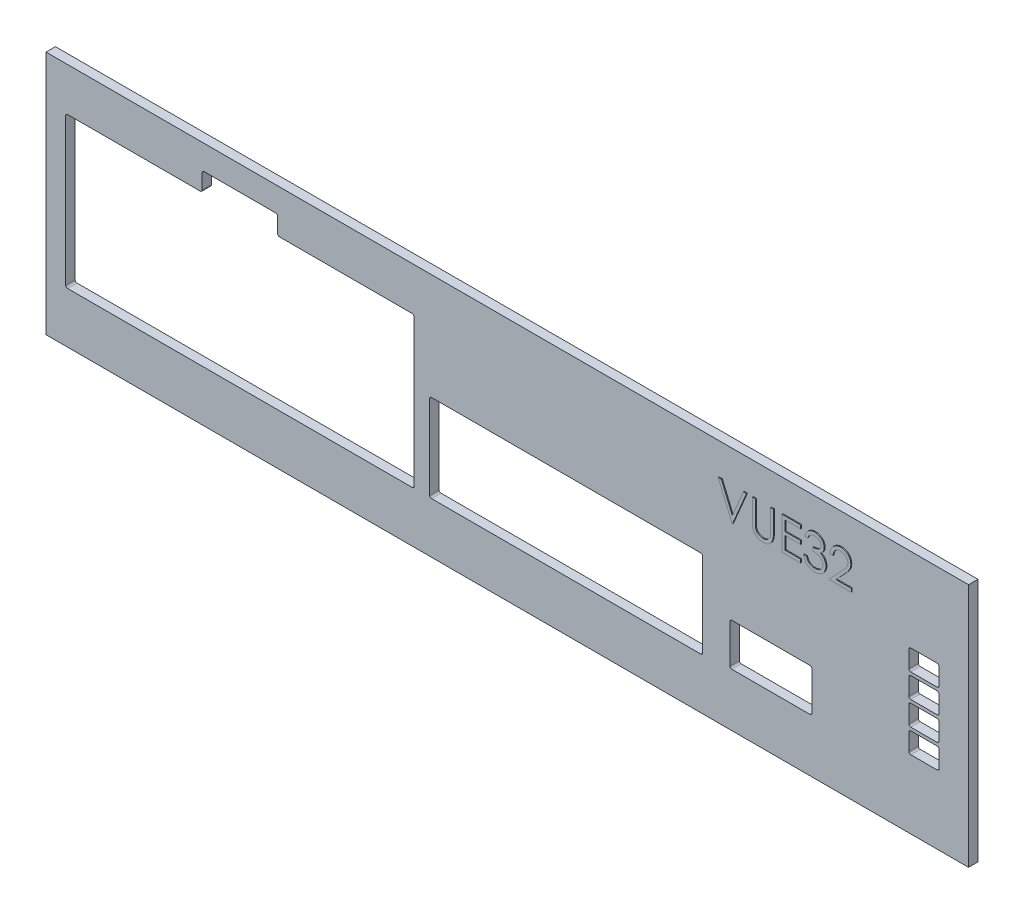
from build123d import *

# Parameters (mm, degrees)
ESQUISSE1_W             = 98
ESQUISSE1_H             = 26
BOSS_EXTRU_1_DEPTH      = 1
ESQUISSE2_W             = 29
ESQUISSE2_H             = 9.3
ESQUISSE2_W_2           = 8.7
ESQUISSE2_H_2           = 4.5
ESQUISSE2_W_3           = 3.2
ESQUISSE2_H_3           = 2.2
ENL_V_MAT_EXTRU_1_DEPTH = 51.705029336
CONG_1_R                = 0.2
BOSS_EXTRU_2_DEPTH      = 0.1


with BuildPart() as part:
    # Esquisse1 → Boss.-Extru.1 (new body)
    with BuildSketch(Plane.XY):
        Rectangle(ESQUISSE1_W, ESQUISSE1_H)
    extrude(amount=BOSS_EXTRU_1_DEPTH)

    # Esquisse2 → Enlèv. mat.-Extru.1 (cut, through all)
    with BuildSketch(Plane.XY.offset(1)):
        Polygon((-46.9074, 8.4), (-32.4074, 8.4), (-32.4074, 10.4), (-24.4074, 10.4), (-24.4074, 8.4), (-9.9074, 8.4), (-9.9074, -7.6), (-46.9074, -7.6), align=None)
        with Locations((6.25, -2.95)):
            Rectangle(ESQUISSE2_W, ESQUISSE2_H)
        with Locations((28, -5.1)):
            Rectangle(ESQUISSE2_W_2, ESQUISSE2_H_2)
        with Locations((44.255985376, 3.01)):
            Rectangle(ESQUISSE2_W_3, ESQUISSE2_H_3)
        with Locations((44.255985376, 0.47)):
            Rectangle(ESQUISSE2_W_3, ESQUISSE2_H_3)
        with Locations((44.255985376, -2.07)):
            Rectangle(ESQUISSE2_W_3, ESQUISSE2_H_3)
        with Locations((44.255985376, -4.61)):
            Rectangle(ESQUISSE2_W_3, ESQUISSE2_H_3)
    extrude(amount=-ENL_V_MAT_EXTRU_1_DEPTH, mode=Mode.SUBTRACT)

    # Congé1
    cong_1_edges = [part.edges().sort_by_distance(p)[0] for p in [
        (45.855985376, -3.51, 0.5),
        (45.855985376, -5.71, 0.5),
        (42.655985376, -5.71, 0.5),
        (42.655985376, -3.51, 0.5),
        (-46.9074, -7.6, 0.5),
        (-46.9074, 8.4, 0.5),
        (-32.4074, 8.4, 0.5),
        (-32.4074, 10.4, 0.5),
        (-24.4074, 10.4, 0.5),
        (-24.4074, 8.4, 0.5),
        (-9.9074, 8.4, 0.5),
        (-9.9074, -7.6, 0.5),
        (-8.25, -7.6, 0.5),
        (-8.25, 1.7, 0.5),
        (20.75, 1.7, 0.5),
        (20.75, -7.6, 0.5),
        (23.65, -7.35, 0.5),
        (23.65, -2.85, 0.5),
        (32.35, -2.85, 0.5),
        (32.35, -7.35, 0.5),
        (45.855985376, 4.11, 0.5),
        (45.855985376, 1.91, 0.5),
        (42.655985376, 1.91, 0.5),
        (42.655985376, 4.11, 0.5),
        (45.855985376, 1.57, 0.5),
        (45.855985376, -0.63, 0.5),
        (42.655985376, -0.63, 0.5),
        (42.655985376, 1.57, 0.5),
        (45.855985376, -0.97, 0.5),
        (45.855985376, -3.17, 0.5),
        (42.655985376, -3.17, 0.5),
        (42.655985376, -0.97, 0.5),
    ]]
    fillet(cong_1_edges, radius=CONG_1_R)

    # Esquisse3 → Boss.-Extru.2 (add)
    with BuildSketch(Plane.XY.offset(1)):
        Polygon((22.502465032, 9.673866066), (22.839003494, 9.673866066), (24.00567016, 6.915652925), (25.172336827, 9.673866066), (25.508875288, 9.673866066), (24.028106058, 6.173866066), (23.983234263, 6.173866066), align=None)
        with BuildLine():
            Line((26.137080417, 9.673866066), (26.451182981, 9.673866066))
            Line((26.451182981, 9.673866066), (26.451182981, 7.576810777))
            add(Edge.make_bspline(
                [(26.451182981, 7.576810777), (26.451136237, 7.547130042), (26.451047532, 7.490805731), (26.451640046, 7.41063743), (26.453299414, 7.339364971), (26.454345574, 7.276713624), (26.456672907, 7.222970876), (26.458570954, 7.177845566), (26.461011511, 7.141551363), (26.463944628, 7.120370437), (26.465205417, 7.111265906)],
                knots=[0, 0, 0, 0, 1.528628734, 2.90083645, 4.128790002, 5.200304208, 6.127813768, 6.898992206, 7.526736466, 8, 8, 8, 8], degree=3))
            add(Edge.make_bspline(
                [(26.465205417, 7.111265906), (26.470382875, 7.078419142), (26.480446062, 7.014576413), (26.506092439, 6.923668131), (26.54190994, 6.841736673), (26.584352983, 6.766225382), (26.640285595, 6.699236022), (26.70728913, 6.637524369), (26.788466898, 6.583552564), (26.878727504, 6.534201753), (26.976012742, 6.49453667), (27.075424008, 6.464543306), (27.175466987, 6.446264406), (27.242443152, 6.444147867), (27.275702211, 6.443096835)],
                knots=[0, 0, 0, 0, 1.035780045, 2.013197591, 2.933192213, 3.817615948, 4.702609284, 5.640816605, 6.646850145, 7.73207398, 8.84249596, 9.914020372, 10.964143139, 12, 12, 12, 12], degree=3))
            add(Edge.make_bspline(
                [(27.275702211, 6.443096835), (27.304255952, 6.444170685), (27.361198514, 6.446312184), (27.445804944, 6.459573615), (27.528205053, 6.48347418), (27.608805733, 6.514313939), (27.684356717, 6.55506153), (27.754900159, 6.602132369), (27.817864094, 6.657343245), (27.875322091, 6.71844359), (27.925357027, 6.78738339), (27.968728169, 6.862661528), (28.004254099, 6.945410875), (28.021797623, 7.003565297), (28.030810385, 7.033441386)],
                knots=[0, 0, 0, 0, 0.994687771, 1.983630487, 2.973142513, 3.978332533, 4.983357753, 5.956394766, 6.925816176, 7.893390482, 8.871859704, 9.88551698, 10.913711441, 12, 12, 12, 12], degree=3))
            add(Edge.make_bspline(
                [(28.030810385, 7.033441386), (28.03381051, 7.045789961), (28.040495998, 7.073307561), (28.046743043, 7.119828851), (28.053249568, 7.174718215), (28.057764138, 7.238370028), (28.062165359, 7.310571001), (28.064798432, 7.391697258), (28.066015465, 7.481454219), (28.066378145, 7.544091381), (28.066567596, 7.576810777)],
                knots=[0, 0, 0, 0, 0.558680831, 1.244966039, 2.062412453, 2.990489873, 4.051219941, 5.244515665, 6.560634259, 8, 8, 8, 8], degree=3))
            Line((28.066567596, 7.576810777), (28.066567596, 9.673866066))
            Line((28.066567596, 9.673866066), (28.38067016, 9.673866066))
            Line((28.38067016, 9.673866066), (28.38067016, 7.559983854))
            add(Edge.make_bspline(
                [(28.38067016, 7.559983854), (28.38041604, 7.521885475), (28.379920108, 7.447534173), (28.375619532, 7.338582814), (28.368762532, 7.235229832), (28.359074444, 7.137461336), (28.346237441, 7.045627176), (28.33196222, 6.958922408), (28.313782687, 6.877969416), (28.292549286, 6.802136998), (28.268275738, 6.729951485), (28.23683459, 6.66144287), (28.20141009, 6.59452847), (28.159395437, 6.530220361), (28.112184054, 6.468233808), (28.058732374, 6.408944733), (28.000808213, 6.351405687), (27.937448653, 6.297092621), (27.869698128, 6.247283944), (27.79775817, 6.203486173), (27.7221814, 6.166462555), (27.643164274, 6.135986631), (27.560673071, 6.113072032), (27.474705712, 6.095996876), (27.385066518, 6.086294578), (27.324101862, 6.084852648), (27.293230256, 6.084122476)],
                knots=[0, 0, 0, 0, 1.316592851, 2.569410997, 3.76748051, 4.895814652, 5.963796859, 6.97159953, 7.931736103, 8.829262218, 9.692595152, 10.560224239, 11.431080259, 12.30701507, 13.211635791, 14.121146779, 15.063487852, 16.031507147, 17.00238618, 17.966455255, 18.938106653, 19.907068911, 20.888905087, 21.893141452, 22.933117798, 24, 24, 24, 24], degree=3))
            add(Edge.make_bspline(
                [(27.293230256, 6.084122476), (27.259561154, 6.084907241), (27.193502495, 6.086446948), (27.096164428, 6.095269698), (27.002850231, 6.111888093), (26.912574354, 6.133048036), (26.826565857, 6.162231774), (26.743672413, 6.196329898), (26.665313732, 6.238207159), (26.590218603, 6.284800552), (26.520393847, 6.33722519), (26.456296444, 6.394365364), (26.397820573, 6.455305741), (26.345951877, 6.520706107), (26.299830992, 6.590057814), (26.260100779, 6.663557054), (26.225987535, 6.74117537), (26.208380968, 6.79512857), (26.199480256, 6.822403726)],
                knots=[0, 0, 0, 0, 1.13879206, 2.234305948, 3.301075583, 4.341971843, 5.366689343, 6.369221514, 7.369726634, 8.367512178, 9.355451585, 10.318319045, 11.268648973, 12.207971039, 13.137398894, 14.081662264, 15.030215811, 16, 16, 16, 16], degree=3))
            add(Edge.make_bspline(
                [(26.199480256, 6.822403726), (26.194303098, 6.841036301), (26.183073727, 6.88145077), (26.171048429, 6.948337258), (26.160939347, 7.025352176), (26.151433789, 7.112500794), (26.145824831, 7.209850661), (26.140907393, 7.317359577), (26.137045774, 7.435157538), (26.137068546, 7.517212054), (26.137080417, 7.559983854)],
                knots=[0, 0, 0, 0, 0.625038921, 1.35572334, 2.194682327, 3.136881307, 4.189498639, 5.346923369, 6.617055217, 8, 8, 8, 8], degree=3))
            Line((26.137080417, 7.559983854), (26.137080417, 9.673866066))
        make_face()
        Polygon((29.278106058, 9.673866066), (31.252465032, 9.673866066), (31.252465032, 9.314891707), (29.592208622, 9.314891707), (29.592208622, 8.23796863), (31.252465032, 8.23796863), (31.252465032, 7.878994271), (29.592208622, 7.878994271), (29.592208622, 6.532840425), (31.252465032, 6.532840425), (31.252465032, 6.173866066), (29.278106058, 6.173866066), align=None)
        with BuildLine():
            Line((32.015285545, 8.866173758), (31.701182981, 8.866173758))
            add(Edge.make_bspline(
                [(31.701182981, 8.866173758), (31.709692531, 8.901406242), (31.726328007, 8.970282867), (31.76102558, 9.068690127), (31.798824836, 9.161813649), (31.84421394, 9.247909723), (31.893722694, 9.328708625), (31.950445416, 9.40237775), (32.011765138, 9.470790715), (32.079590088, 9.531503953), (32.150718749, 9.586481682), (32.226153369, 9.633356739), (32.304376263, 9.673680892), (32.385929396, 9.706901124), (32.471055567, 9.731926648), (32.558985191, 9.750083453), (32.649948691, 9.761874568), (32.711696282, 9.763025331), (32.743049968, 9.763609656)],
                knots=[0, 0, 0, 0, 1.162005537, 2.271625781, 3.343758855, 4.383309926, 5.390229558, 6.379919256, 7.361854164, 8.333198761, 9.295911338, 10.242430842, 11.177959212, 12.116337295, 13.062827104, 14.020064771, 14.994644689, 16, 16, 16, 16], degree=3))
            add(Edge.make_bspline(
                [(32.743049968, 9.763609656), (32.78873271, 9.762230425), (32.879101721, 9.75950205), (33.011864768, 9.734587613), (33.139891587, 9.695162481), (33.261780835, 9.640688754), (33.374999267, 9.573501441), (33.475735454, 9.493536704), (33.562623965, 9.402337402), (33.635518343, 9.301604838), (33.692593342, 9.193949329), (33.734679715, 9.083149172), (33.760301396, 8.9694672), (33.763621953, 8.892709921), (33.765285545, 8.854254688)],
                knots=[0, 0, 0, 0, 1.083050992, 2.142477498, 3.193116406, 4.255571735, 5.30263384, 6.308962982, 7.297363603, 8.282367274, 9.249857812, 10.179914175, 11.08814088, 12, 12, 12, 12], degree=3))
            add(Edge.make_bspline(
                [(33.765285545, 8.854254688), (33.764121954, 8.817247893), (33.761844987, 8.744831339), (33.742511281, 8.639109841), (33.709975018, 8.539468241), (33.664905256, 8.445487079), (33.606563705, 8.357762239), (33.535891008, 8.276096348), (33.452388347, 8.20012719), (33.389109409, 8.156607717), (33.356531538, 8.134202604)],
                knots=[0, 0, 0, 0, 1.024540389, 2.004866551, 2.965041327, 3.920577974, 4.882998113, 5.874504559, 6.905732034, 8, 8, 8, 8], degree=3))
            add(Edge.make_bspline(
                [(33.356531538, 8.134202604), (33.393763293, 8.116224433), (33.467530167, 8.080604475), (33.568080697, 8.010748718), (33.659358572, 7.93009237), (33.710262291, 7.867149717), (33.735838429, 7.83552472)],
                knots=[0, 0, 0, 0, 1.015518401, 2.012035669, 3.001164323, 4, 4, 4, 4], degree=3))
            add(Edge.make_bspline(
                [(33.735838429, 7.83552472), (33.752679772, 7.812466968), (33.786086668, 7.766729052), (33.827322202, 7.693192626), (33.864731316, 7.618841136), (33.893881535, 7.54168173), (33.916455402, 7.462608717), (33.932591434, 7.381486321), (33.942615575, 7.298248298), (33.944051127, 7.241935818), (33.944772724, 7.213629688)],
                knots=[0, 0, 0, 0, 1.025084078, 2.033381695, 3.024893161, 4.013698104, 4.991890475, 5.976764909, 6.982997093, 8, 8, 8, 8], degree=3))
            add(Edge.make_bspline(
                [(33.944772724, 7.213629688), (33.942978211, 7.164619967), (33.939397629, 7.066831165), (33.907393554, 6.922356443), (33.857780314, 6.781130941), (33.787323378, 6.646056102), (33.701455869, 6.519675721), (33.599298545, 6.406599412), (33.482012136, 6.309400807), (33.351206487, 6.228190579), (33.209489359, 6.163272657), (33.057913767, 6.118215214), (32.898663713, 6.088869214), (32.789456415, 6.085722346), (32.733935385, 6.084122476)],
                knots=[0, 0, 0, 0, 0.955779014, 1.907060117, 2.875433937, 3.871313158, 4.872415639, 5.851225146, 6.836215519, 7.83643374, 8.849228613, 9.86973379, 10.916971861, 12, 12, 12, 12], degree=3))
            add(Edge.make_bspline(
                [(32.733935385, 6.084122476), (32.696516084, 6.084990689), (32.622887379, 6.086699044), (32.514643881, 6.098377645), (32.411322181, 6.11970765), (32.312782584, 6.148410955), (32.218937547, 6.184802698), (32.130073442, 6.230121396), (32.045643548, 6.283432898), (31.966444597, 6.345366485), (31.89248603, 6.414647825), (31.825733305, 6.492506835), (31.765073512, 6.577504239), (31.712130874, 6.670627295), (31.664493921, 6.770672553), (31.625312964, 6.878921051), (31.590827396, 6.994405073), (31.574793932, 7.074882813), (31.566567596, 7.116173758)],
                knots=[0, 0, 0, 0, 1.048658725, 2.063410685, 3.046034179, 4.001477787, 4.936774919, 5.862367409, 6.792675028, 7.730719943, 8.675894397, 9.627829632, 10.600096036, 11.597688215, 12.626045268, 13.701542398, 14.82072376, 16, 16, 16, 16], degree=3))
            Line((31.566567596, 7.116173758), (31.88067016, 7.116173758))
            add(Edge.make_bspline(
                [(31.88067016, 7.116173758), (31.888853452, 7.089224745), (31.904770664, 7.036806573), (31.931864962, 6.961366268), (31.962733234, 6.892208214), (31.995847793, 6.828825092), (32.030626239, 6.77059269), (32.069541164, 6.719050821), (32.109710309, 6.671935619), (32.139989663, 6.645391007), (32.154808782, 6.63239972)],
                knots=[0, 0, 0, 0, 1.198163088, 2.33053128, 3.407730985, 4.417276592, 5.372219308, 6.28897303, 7.162600585, 8, 8, 8, 8], degree=3))
            add(Edge.make_bspline(
                [(32.154808782, 6.63239972), (32.174405358, 6.617291386), (32.213538021, 6.587121354), (32.277306252, 6.548619726), (32.344371139, 6.5152587), (32.416185813, 6.489775005), (32.491200583, 6.468197344), (32.570627948, 6.454076825), (32.653767166, 6.444388653), (32.710534929, 6.443533722), (32.739544359, 6.443096835)],
                knots=[0, 0, 0, 0, 0.946170439, 1.889420265, 2.845303464, 3.807233317, 4.801018734, 5.828864929, 6.890507805, 8, 8, 8, 8], degree=3))
            add(Edge.make_bspline(
                [(32.739544359, 6.443096835), (32.772297862, 6.44371274), (32.836344508, 6.44491709), (32.929799368, 6.455992797), (33.018706815, 6.47212321), (33.102079741, 6.497036193), (33.181010248, 6.527817045), (33.254391898, 6.56646545), (33.323188004, 6.611810172), (33.38651741, 6.66334933), (33.443462917, 6.719770825), (33.49360243, 6.778783896), (33.536227092, 6.840139726), (33.57061067, 6.904177847), (33.59776122, 6.970633076), (33.616244421, 7.039691905), (33.629095936, 7.110789171), (33.630142548, 7.15911814), (33.63067016, 7.183481451)],
                knots=[0, 0, 0, 0, 1.217147791, 2.380027433, 3.494444702, 4.572153297, 5.609568379, 6.639424714, 7.649109417, 8.668170816, 9.669597737, 10.625200337, 11.543417969, 12.441394052, 13.322311151, 14.205496177, 15.095365482, 16, 16, 16, 16], degree=3))
            add(Edge.make_bspline(
                [(33.63067016, 7.183481451), (33.629139859, 7.216092789), (33.62608687, 7.281153198), (33.602778291, 7.376870772), (33.564439427, 7.469094184), (33.510766915, 7.556249974), (33.445431187, 7.637025876), (33.36906628, 7.709097358), (33.281038051, 7.76856745), (33.200018182, 7.809656106), (33.128253026, 7.837693181), (33.066837641, 7.856368146), (32.998081038, 7.872181801), (32.922814689, 7.886894073), (32.840471473, 7.899415421), (32.751141035, 7.909857237), (32.654805273, 7.918212278), (32.588114107, 7.921943373), (32.553747083, 7.923866066)],
                knots=[0, 0, 0, 0, 1.07054697, 2.135767047, 3.216561865, 4.33974944, 5.486079747, 6.621378074, 7.775625952, 8.963672916, 9.598146892, 10.304877434, 11.070270905, 11.915000392, 12.823868403, 13.805723172, 14.86925407, 16, 16, 16, 16], degree=3))
            Line((32.553747083, 7.923866066), (32.553747083, 8.282840425))
            add(Edge.make_bspline(
                [(32.553747083, 8.282840425), (32.597048249, 8.283575229), (32.681864596, 8.285014529), (32.8057589, 8.302422539), (32.924232212, 8.326503167), (33.034658954, 8.363388359), (33.135307668, 8.406228656), (33.22262727, 8.456080866), (33.295394417, 8.511495615), (33.353255489, 8.573328224), (33.396784717, 8.639643272), (33.428611515, 8.708759929), (33.447411841, 8.78128399), (33.449921508, 8.830778658), (33.451182981, 8.855656931)],
                knots=[0, 0, 0, 0, 1.321986639, 2.589447074, 3.816329219, 5.01088745, 6.139805852, 7.153945165, 8.075214402, 8.924034688, 9.728124013, 10.488707548, 11.240355623, 12, 12, 12, 12], degree=3))
            add(Edge.make_bspline(
                [(33.451182981, 8.855656931), (33.45076857, 8.873934676), (33.449944119, 8.910297384), (33.439546841, 8.963422452), (33.4239228, 9.014923398), (33.402443071, 9.064581208), (33.373692872, 9.112051482), (33.339286885, 9.157738931), (33.298318785, 9.20138271), (33.251373338, 9.24206303), (33.200961533, 9.280832267), (33.145711758, 9.313745904), (33.087289883, 9.341890966), (33.025631229, 9.365100468), (32.960535698, 9.382559756), (32.892309141, 9.395095598), (32.820821457, 9.402933253), (32.772049725, 9.404061668), (32.747256699, 9.404635297)],
                knots=[0, 0, 0, 0, 0.884392785, 1.759457502, 2.611959086, 3.489218968, 4.37281399, 5.2945488, 6.255912374, 7.266815255, 8.301784654, 9.332968512, 10.37626691, 11.440494194, 12.520033166, 13.637162961, 14.798855837, 16, 16, 16, 16], degree=3))
            add(Edge.make_bspline(
                [(32.747256699, 9.404635297), (32.707405031, 9.403243935), (32.629565454, 9.400526281), (32.517350537, 9.376723268), (32.413031203, 9.338745184), (32.333292537, 9.293412165), (32.274409963, 9.248661731), (32.232333024, 9.209579345), (32.191012514, 9.166146521), (32.153166837, 9.115688146), (32.11489286, 9.061621355), (32.080048299, 9.001197674), (32.046188607, 8.93599328), (32.025786057, 8.889897645), (32.015285545, 8.866173758)],
                knots=[0, 0, 0, 0, 1.472543308, 2.876219568, 4.221790263, 5.565193594, 6.249813518, 6.953379497, 7.687249741, 8.463570142, 9.283606569, 10.136032583, 11.040678096, 12, 12, 12, 12], degree=3))
        make_face()
        with BuildLine():
            Line((34.707593237, 8.596942989), (34.393490673, 8.596942989))
            add(Edge.make_bspline(
                [(34.393490673, 8.596942989), (34.395537826, 8.638613877), (34.39955838, 8.720454391), (34.418386669, 8.839778298), (34.445327546, 8.953833096), (34.483419001, 9.06170301), (34.530725278, 9.164341818), (34.587455306, 9.261341833), (34.654649156, 9.352333022), (34.73085589, 9.436471865), (34.813624529, 9.513659436), (34.902930469, 9.580314679), (34.996775496, 9.63663235), (35.094874895, 9.683713592), (35.198335459, 9.719053438), (35.306218316, 9.745275078), (35.418997453, 9.761051423), (35.495837475, 9.762747209), (35.534916955, 9.763609656)],
                knots=[0, 0, 0, 0, 1.10065271, 2.161652631, 3.183658789, 4.190468796, 5.17591951, 6.163126047, 7.15150782, 8.156236427, 9.156009102, 10.134482811, 11.092018607, 12.041330605, 13.001268258, 13.972401359, 14.968799086, 16, 16, 16, 16], degree=3))
            add(Edge.make_bspline(
                [(35.534916955, 9.763609656), (35.573295029, 9.762711199), (35.648706574, 9.760945764), (35.758768588, 9.745784735), (35.863545883, 9.722039144), (35.962833649, 9.688723727), (36.055839714, 9.6439393), (36.143262758, 9.590141761), (36.226143569, 9.52792193), (36.300750353, 9.454668116), (36.369258432, 9.376465732), (36.428360687, 9.292977828), (36.478973851, 9.206748543), (36.52116153, 9.117120341), (36.552217669, 9.023249313), (36.575795877, 8.92650211), (36.589123291, 8.825877299), (36.591168715, 8.757770743), (36.592208622, 8.723144912)],
                knots=[0, 0, 0, 0, 1.111607364, 2.184268762, 3.212621178, 4.221274766, 5.211760367, 6.196651075, 7.1921475, 8.207485113, 9.220403448, 10.201281604, 11.166441695, 12.114753415, 13.065576456, 14.026450734, 14.996634279, 16, 16, 16, 16], degree=3))
            add(Edge.make_bspline(
                [(36.592208622, 8.723144912), (36.590515359, 8.674397078), (36.587158548, 8.577756864), (36.558444171, 8.435742001), (36.51359766, 8.298148582), (36.459600303, 8.18741128), (36.405127859, 8.098177786), (36.356040351, 8.024709081), (36.29857554, 7.945603613), (36.231897042, 7.861126276), (36.15738417, 7.77061537), (36.074362007, 7.674125575), (35.982238525, 7.572653805), (35.917580024, 7.503348204), (35.884075609, 7.467435777)],
                knots=[0, 0, 0, 0, 1.184426356, 2.348067706, 3.509069118, 4.696110526, 5.333549288, 6.050745305, 6.844228056, 7.710549037, 8.667450064, 9.695053472, 10.805634456, 12, 12, 12, 12], degree=3))
            Line((35.884075609, 7.467435777), (35.008374487, 6.532840425))
            Line((35.008374487, 6.532840425), (36.637080417, 6.532840425))
            Line((36.637080417, 6.532840425), (36.637080417, 6.173866066))
            Line((36.637080417, 6.173866066), (34.258875288, 6.173866066))
            Line((34.258875288, 6.173866066), (35.616247083, 7.622383694))
            add(Edge.make_bspline(
                [(35.616247083, 7.622383694), (35.64929497, 7.656882001), (35.712773197, 7.723146187), (35.802555774, 7.819889147), (35.883194762, 7.909638688), (35.955212155, 7.992225237), (36.01704566, 8.068856804), (36.071917892, 8.137051508), (36.115883483, 8.199805958), (36.163598879, 8.272546572), (36.20981286, 8.361358889), (36.249525216, 8.469892579), (36.273740065, 8.581619831), (36.2766449, 8.657121868), (36.278106058, 8.69510004)],
                knots=[0, 0, 0, 0, 1.329631726, 2.553950428, 3.673215718, 4.687767853, 5.603093632, 6.413772471, 7.123043292, 7.734684054, 8.834405432, 9.900288307, 10.943827018, 12, 12, 12, 12], degree=3))
            add(Edge.make_bspline(
                [(36.278106058, 8.69510004), (36.277470315, 8.718981439), (36.276217389, 8.766047089), (36.265159692, 8.835052848), (36.248449186, 8.901617662), (36.224503928, 8.965946281), (36.192897188, 9.027391933), (36.154423808, 9.086029413), (36.110033744, 9.142718379), (36.058682475, 9.195871677), (36.002270955, 9.244552882), (35.942676706, 9.287676967), (35.879626601, 9.323716078), (35.813386479, 9.353259575), (35.74414101, 9.376434957), (35.671756265, 9.392493536), (35.596432248, 9.40257602), (35.544998753, 9.403940192), (35.518791154, 9.404635297)],
                knots=[0, 0, 0, 0, 0.991446411, 1.95395049, 2.89581595, 3.838931463, 4.798493298, 5.75982156, 6.748411868, 7.785213223, 8.824556874, 9.840280684, 10.836137867, 11.835679398, 12.848801643, 13.863922112, 14.911575587, 16, 16, 16, 16], degree=3))
            add(Edge.make_bspline(
                [(35.518791154, 9.404635297), (35.491420321, 9.403920264), (35.437668525, 9.402516059), (35.358749492, 9.392693395), (35.283463714, 9.375747555), (35.211621811, 9.35257088), (35.143102226, 9.323112332), (35.078238182, 9.286420587), (35.017175292, 9.242637094), (34.959798769, 9.192996537), (34.90693479, 9.137728936), (34.860487914, 9.076118973), (34.8199039, 9.009291558), (34.784494666, 8.937427007), (34.755738976, 8.859873227), (34.733765826, 8.776905522), (34.716378979, 8.688884141), (34.710570459, 8.628099056), (34.707593237, 8.596942989)],
                knots=[0, 0, 0, 0, 1.031018746, 2.02475058, 2.990194455, 3.934040569, 4.864654155, 5.795059489, 6.735614925, 7.690564532, 8.649604399, 9.611025574, 10.590972636, 11.591080095, 12.624614302, 13.701020113, 14.821632451, 16, 16, 16, 16], degree=3))
        make_face()
    extrude(amount=BOSS_EXTRU_2_DEPTH)


solid = part.part
